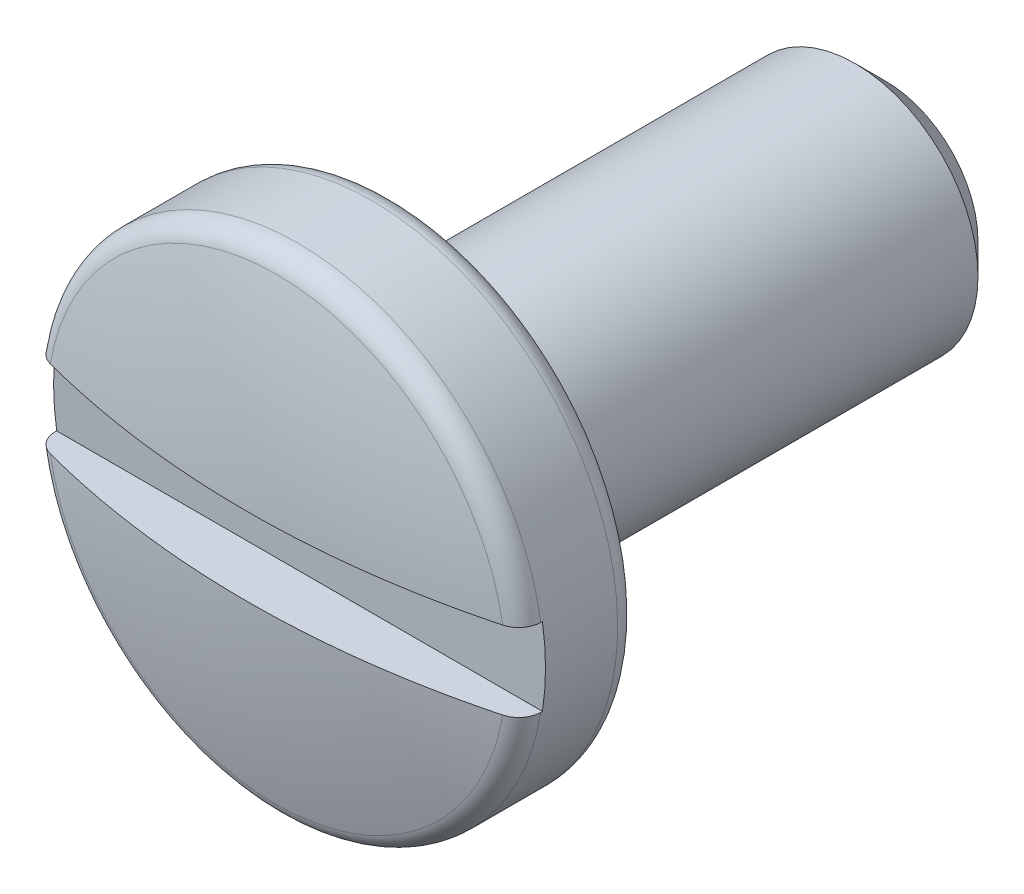
from build123d import *

# Parameters (mm, degrees)
SKETCH3_W               = 12
SKETCH3_H               = 3
CHAMFER1_SIZE           = 0.75
SKETCH8_W               = 3.6
SKETCH8_H               = 6
CUT_EXTRUDE_THIN2_START = 14.3
SKETCH12_W              = 12
SKETCH12_H              = 1.9
CUT_EXTRUDE_THIN2_DEPTH = 1.3


with BuildPart() as part:
    # Sketch3 → Revolve1 (revolve)
    with BuildSketch(Plane(origin=(0, 0, 0), x_dir=(0, 0, -1), z_dir=(1, 0, 0)), mode=Mode.PRIVATE) as revolve1_sk:
        with Locations((-6, 1.5)):
            Rectangle(SKETCH3_W, SKETCH3_H)
    revolve(revolve1_sk.sketch.rotate(Axis((0, 0, 0), (0, 0, -1)), 90), axis=Axis((0, 0, 0), (0, 0, -1)))

    # Chamfer1
    chamfer1_edges = [part.edges().sort_by_distance(p)[0] for p in [
        (-3, 0, 0),
    ]]
    chamfer(chamfer1_edges, length=CHAMFER1_SIZE)

    # Sketch8 → Revolve2 (revolve)
    with BuildSketch(Plane(origin=(0, 0, 0), x_dir=(0, 0, -1), z_dir=(1, 0, 0)), mode=Mode.PRIVATE) as revolve2_sk:
        with Locations((-13.8, 3)):
            Rectangle(SKETCH8_W, SKETCH8_H)
    revolve(revolve2_sk.sketch.rotate(Axis((0, 0, 0), (0, 0, 1)), 90), axis=Axis((0, 0, 0), (0, 0, 1)))

    # Sketch11 → Cut-Revolve3 (revolve, cut)
    with BuildSketch(Plane(origin=(0, 0, 0), x_dir=(0, 0, -1), z_dir=(1, 0, 0)), mode=Mode.PRIVATE) as cut_revolve3_sk:
        with BuildLine():
            Line((-14.34, 6), (-12.54, 6))
            ThreePointArc((-12.54, 6), (-12.158162338, 5.841837662), (-12, 5.46))
            Line((-12, 5.46), (-11.365, 5.46))
            Line((-11.365, 5.46), (-11.365, 6.635))
            Line((-11.365, 6.635), (-16.235, 6.635))
            Line((-16.235, 6.635), (-16.235, 0))
            Line((-16.235, 0), (-15.6, 0))
            ThreePointArc((-15.6, 0), (-15.41458949, 2.824231581), (-14.861540653, 5.599983383))
            ThreePointArc((-14.861540653, 5.599983383), (-14.668640361, 5.88848047), (-14.34, 6))
        make_face()
    revolve(cut_revolve3_sk.sketch.rotate(Axis((0, 0, 15.6), (0, 0, -1)), 180), axis=Axis((0, 0, 15.6), (0, 0, -1)), mode=Mode.SUBTRACT)

    # Sketch12 → Cut-Extrude-Thin2 (cut)
    with BuildSketch(Plane.XY.offset(CUT_EXTRUDE_THIN2_START)):
        Rectangle(SKETCH12_W, SKETCH12_H)
    extrude(amount=CUT_EXTRUDE_THIN2_DEPTH, mode=Mode.SUBTRACT)


solid = part.part
